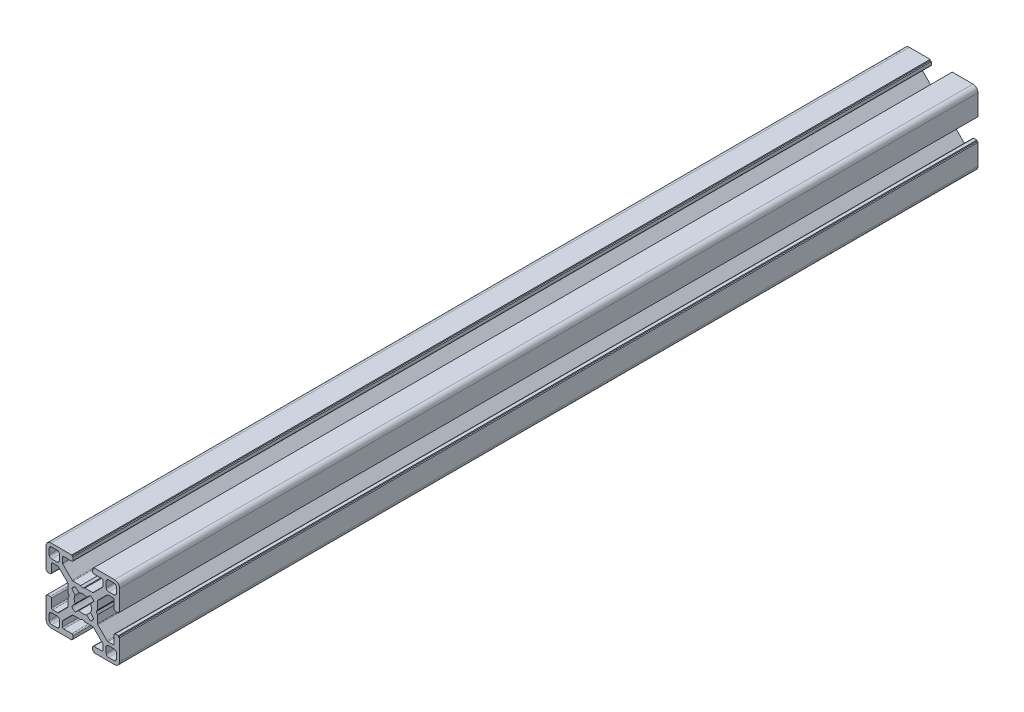
from build123d import *

# Parameters (mm, degrees)
BOSS_EXTRUDE1_DEPTH = 175
CIRPATTERN1_COUNT   = 4


with BuildPart() as part:
    # Sketch3 → Boss-Extrude1 (new, symmetric)
    with BuildSketch(Plane.XY):
        with BuildLine():
            Line((-4.503841895, 3.156803476), (-3.14772708, 1.530298739))
            ThreePointArc((-3.14772708, 1.530298739), (-3.410794979, 0.785160882), (-3.5, 0))
            Line((-3.5, 0), (-5.5, 0))
            Line((-5.5, 0), (-6, 0.866025404))
            Line((-6, 0.866025404), (-6, 3.996841995))
            ThreePointArc((-6, 3.996841995), (-6.038060234, 4.188183711), (-6.146446609, 4.350395385))
            Line((-6.146446609, 4.350395385), (-9.917104615, 8.121053391))
            ThreePointArc((-9.917104615, 8.121053391), (-10.079316289, 8.229439766), (-10.270658005, 8.2675))
            Line((-10.270658005, 8.2675), (-12.29, 8.2675))
            ThreePointArc((-12.29, 8.2675), (-12.643553391, 8.121053391), (-12.79, 7.7675))
            Line((-12.79, 7.7675), (-12.79, 4.5))
            ThreePointArc((-12.79, 4.5), (-12.936446609, 4.146446609), (-13.29, 4))
            Line((-13.29, 4), (-14.5, 4))
            Line((-14.5, 4), (-14.5, 4.5))
            Line((-14.5, 4.5), (-15, 4.5))
            Line((-15, 4.5), (-15, 12.968))
            ThreePointArc((-15, 12.968), (-14.404840979, 14.404840979), (-12.968, 15))
            Line((-12.968, 15), (-4.5, 15))
            Line((-4.5, 15), (-4.5, 14.5))
            Line((-4.5, 14.5), (-4, 14.5))
            Line((-4, 14.5), (-4, 13.29))
            ThreePointArc((-4, 13.29), (-4.146446609, 12.936446609), (-4.5, 12.79))
            Line((-4.5, 12.79), (-7.7675, 12.79))
            ThreePointArc((-7.7675, 12.79), (-8.121053391, 12.643553391), (-8.2675, 12.29))
            Line((-8.2675, 12.29), (-8.2675, 10.270658005))
            ThreePointArc((-8.2675, 10.270658005), (-8.229439766, 10.079316289), (-8.121053391, 9.917104615))
            Line((-8.121053391, 9.917104615), (-4.350395385, 6.146446609))
            ThreePointArc((-4.350395385, 6.146446609), (-4.188183711, 6.038060234), (-3.996841995, 6))
            Line((-3.996841995, 6), (-0.866025404, 6))
            Line((-0.866025404, 6), (0, 5.5))
            Line((0, 5.5), (0, 3.5))
            ThreePointArc((0, 3.5), (-0.785160882, 3.410794979), (-1.530298739, 3.14772708))
            Line((-1.530298739, 3.14772708), (-3.156803476, 4.503841895))
            ThreePointArc((-3.156803476, 4.503841895), (-3.889087297, 3.889087297), (-4.503841895, 3.156803476))
        make_face()
        with BuildLine():
            Line((-12.705, 9.5135), (-10.5135, 9.5135))
            ThreePointArc((-10.5135, 9.5135), (-9.806393219, 9.806393219), (-9.5135, 10.5135))
            Line((-9.5135, 10.5135), (-9.5135, 12.705))
            ThreePointArc((-9.5135, 12.705), (-9.806393219, 13.412106781), (-10.5135, 13.705))
            Line((-10.5135, 13.705), (-12.705, 13.705))
            ThreePointArc((-12.705, 13.705), (-13.412106781, 13.412106781), (-13.705, 12.705))
            Line((-13.705, 12.705), (-13.705, 10.5135))
            ThreePointArc((-13.705, 10.5135), (-13.412106781, 9.806393219), (-12.705, 9.5135))
        make_face(mode=Mode.SUBTRACT)
    boss_extrude1 = extrude(amount=BOSS_EXTRUDE1_DEPTH, both=True)

    # CirPattern1: Boss-Extrude1 ×4 about axis
    cirpattern1_axis = Axis((0, 0, 0), (0, 0, 1))
    for i in range(1, CIRPATTERN1_COUNT):
        add(boss_extrude1.rotate(cirpattern1_axis, i * 360 / CIRPATTERN1_COUNT))


solid = part.part
